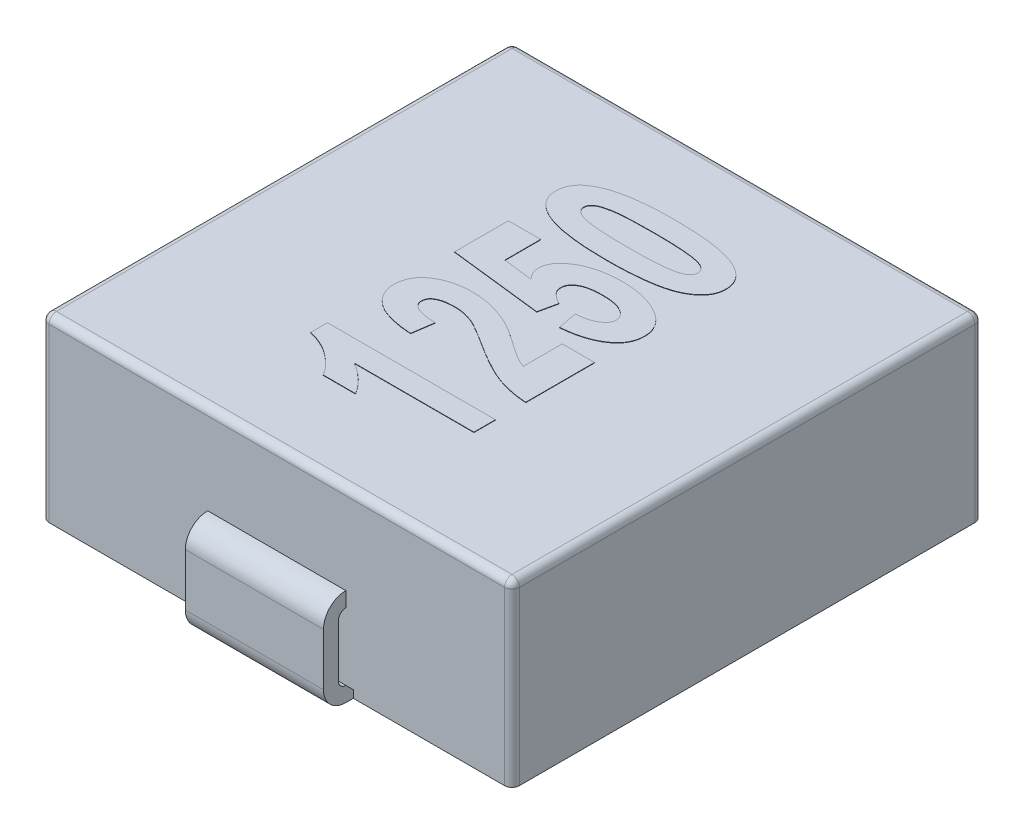
from build123d import *

# Parameters (mm, degrees)
EXTRUDE_1_DEPTH     = 4.8
SKETCH_2_W          = 4.1
SKETCH_2_H          = 3.2
CUT_EXTRUDE_1_DEPTH = 0.2
EXTRUDE_1_2_DEPTH   = 1.85
EXTRUDE_2_DEPTH     = 1.85
FILLET_1_R          = 0.2
EXTRUDE_2_2_DEPTH   = 0.01


with BuildPart() as part:
    # Эскиз1 → Extrude 1 (new body)
    with BuildSketch(Plane(origin=(0, 0, 0), x_dir=(1, 0, 0), z_dir=(0, 1, 0))):
        with BuildLine():
            Line((-6.1, -6.3), (6.1, -6.3))
            ThreePointArc((6.1, -6.3), (6.241421356, -6.241421356), (6.3, -6.1))
            Line((6.3, -6.1), (6.3, 6.1))
            ThreePointArc((6.3, 6.1), (6.241421356, 6.241421356), (6.1, 6.3))
            Line((6.1, 6.3), (-6.1, 6.3))
            ThreePointArc((-6.1, 6.3), (-6.241421356, 6.241421356), (-6.3, 6.1))
            Line((-6.3, 6.1), (-6.3, -6.1))
            ThreePointArc((-6.3, -6.1), (-6.241421356, -6.241421356), (-6.1, -6.3))
        make_face()
    extrude(amount=EXTRUDE_1_DEPTH)

    # Эскиз2 → Вырез-Вытянуть1 (cut)
    with BuildSketch(Plane.XZ):
        with Locations((0, 4.7)):
            Rectangle(SKETCH_2_W, SKETCH_2_H)
        with Locations((0, -4.7)):
            Rectangle(SKETCH_2_W, SKETCH_2_H)
    extrude(amount=-CUT_EXTRUDE_1_DEPTH, mode=Mode.SUBTRACT)

    # Эскиз3 → Extrude 1 2 (add, symmetric)
    with BuildSketch(Plane(origin=(0, 0, 0), x_dir=(0, 0, -1), z_dir=(1, 0, 0))):
        with BuildLine():
            ThreePointArc((-6.3, 2.4), (-6.724264069, 2.224264069), (-6.9, 1.8))
            Line((-6.9, 1.8), (-6.9, 0.4))
            ThreePointArc((-6.9, 0.4), (-6.724264069, -0.024264069), (-6.3, -0.2))
            Line((-6.3, -0.2), (-3.8, -0.2))
            Line((-3.8, -0.2), (-3.8, 0.2))
            Line((-3.8, 0.2), (-6.3, 0.2))
            ThreePointArc((-6.3, 0.2), (-6.441421356, 0.258578644), (-6.5, 0.4))
            Line((-6.5, 0.4), (-6.5, 1.8))
            ThreePointArc((-6.5, 1.8), (-6.441421356, 1.941421356), (-6.3, 2))
            Line((-6.3, 2), (-6.3, 2.4))
        make_face()
    extrude(amount=EXTRUDE_1_2_DEPTH, both=True)

    # Эскиз3<3> → Extrude 2 (add, symmetric)
    with BuildSketch(Plane(origin=(0, 0, 0), x_dir=(0, 0, -1), z_dir=(1, 0, 0))):
        with BuildLine():
            ThreePointArc((6.3, 2.4), (6.724264069, 2.224264069), (6.9, 1.8))
            Line((6.9, 1.8), (6.9, 0.4))
            ThreePointArc((6.9, 0.4), (6.724264069, -0.024264069), (6.3, -0.2))
            Line((6.3, -0.2), (3.8, -0.2))
            Line((3.8, -0.2), (3.8, 0.1))
            Line((3.8, 0.1), (6.3, 0.1))
            ThreePointArc((6.3, 0.1), (6.512132034, 0.187867966), (6.6, 0.4))
            Line((6.6, 0.4), (6.6, 1.8))
            ThreePointArc((6.6, 1.8), (6.512132034, 2.012132034), (6.3, 2.1))
            Line((6.3, 2.1), (6.3, 2.4))
        make_face()
    extrude(amount=EXTRUDE_2_DEPTH, both=True)

    # Скругление1
    fillet_1_edges = [part.edges().sort_by_distance(p)[0] for p in [
        (-6.241421356, 4.8, 6.241421356),
        (-6.3, 4.8, 0),
        (-6.241421356, 4.8, -6.241421356),
        (0, 4.8, -6.3),
        (6.241421356, 4.8, -6.241421356),
        (6.3, 4.8, 0),
        (6.241421356, 4.8, 6.241421356),
        (0, 4.8, 6.3),
    ]]
    fillet(fillet_1_edges, radius=FILLET_1_R)

    # Эскиз4 → Extrude 2 2 (add)
    # profile 1 of 4: a face of its own
    with BuildSketch(Plane(origin=(0, 4.8, 0), x_dir=(1, 0, 0), z_dir=(0, 1, 0))):
        with BuildLine():
            Line((2.3, -2.742307692), (2.3, -3.319230769))
            Line((2.3, -3.319230769), (-0.903725962, -3.319230769))
            add(Edge.make_bspline(
                [(-0.903725962, -3.319230769), (-0.86406372, -3.343713677), (-0.786078708, -3.391852658), (-0.675919252, -3.470855691), (-0.573321827, -3.552688159), (-0.478055637, -3.637116831), (-0.392438312, -3.726154518), (-0.313650575, -3.817422523), (-0.241646265, -3.911528035), (-0.200936704, -3.978406796), (-0.180769231, -4.011538462)],
                knots=[0, 0, 0, 0, 1.105827385, 2.17430884, 3.214432552, 4.219349929, 5.192600286, 6.143147108, 7.080117071, 8, 8, 8, 8], degree=3))
            Line((-0.180769231, -4.011538462), (-1.046153846, -4.011538462))
            add(Edge.make_bspline(
                [(-1.046153846, -4.011538462), (-1.068012691, -3.973910311), (-1.114805226, -3.893360922), (-1.211368323, -3.778972532), (-1.3302216, -3.658579268), (-1.471776622, -3.536727787), (-1.631879563, -3.420391895), (-1.808442443, -3.321497819), (-1.998820885, -3.243911517), (-2.132228541, -3.20897421), (-2.2, -3.191225962)],
                knots=[0, 0, 0, 0, 0.717406847, 1.535730084, 2.462009094, 3.510396949, 4.616124579, 5.724576378, 6.844078492, 8, 8, 8, 8], degree=3))
            Line((-2.2, -3.191225962), (-2.2, -2.742307692))
            Line((-2.2, -2.742307692), (2.3, -2.742307692))
        make_face()
    # profile 2 of 4: a face of its own
    with BuildSketch(Plane(origin=(0, 4.8, 0), x_dir=(1, 0, 0), z_dir=(0, 1, 0))):
        with BuildLine():
            Line((1.434615385, -0.088461538), (2.3, -0.088461538))
            Line((2.3, -0.088461538), (2.3, -1.934615385))
            add(Edge.make_bspline(
                [(2.3, -1.934615385), (2.226259979, -1.928455358), (2.079932751, -1.916231606), (1.864264437, -1.879545312), (1.654338523, -1.82897304), (1.482179213, -1.774531346), (1.342517386, -1.720494417), (1.230154314, -1.670293389), (1.108989011, -1.613191077), (0.981052538, -1.544184217), (0.843567642, -1.469285953), (0.697876089, -1.38518046), (0.545110167, -1.291176511), (0.44084456, -1.225007711), (0.387139423, -1.190925481)],
                knots=[0, 0, 0, 0, 1.2811081, 2.542187998, 3.784214526, 5.018585627, 5.666093998, 6.376792336, 7.149597247, 7.985321744, 8.893657631, 9.861256989, 10.89837609, 12, 12, 12, 12], degree=3))
            add(Edge.make_bspline(
                [(0.387139423, -1.190925481), (0.34421776, -1.163508022), (0.262509471, -1.111314479), (0.144848303, -1.037769714), (0.037849474, -0.973397862), (-0.057912951, -0.915924757), (-0.143416097, -0.867500526), (-0.217924559, -0.826603489), (-0.281986303, -0.794697701), (-0.321628324, -0.777618527), (-0.339423077, -0.769951923)],
                knots=[0, 0, 0, 0, 1.454327433, 2.768546135, 3.961926122, 5.019930819, 5.957524631, 6.767609832, 7.446797167, 8, 8, 8, 8], degree=3))
            add(Edge.make_bspline(
                [(-0.339423077, -0.769951923), (-0.383016183, -0.753744776), (-0.468449265, -0.721982266), (-0.599671217, -0.690011543), (-0.729653911, -0.668849496), (-0.816505367, -0.666532893), (-0.859555288, -0.665384615)],
                knots=[0, 0, 0, 0, 1.045072882, 2.048117354, 3.032504461, 4, 4, 4, 4], degree=3))
            add(Edge.make_bspline(
                [(-0.859555288, -0.665384615), (-0.904382267, -0.666329325), (-0.988621083, -0.668104621), (-1.107026047, -0.683486123), (-1.209631952, -0.707429633), (-1.295525479, -0.743169171), (-1.36365812, -0.788165168), (-1.414633234, -0.841526964), (-1.444123359, -0.905855704), (-1.448023453, -0.951464858), (-1.45, -0.974579327)],
                knots=[0, 0, 0, 0, 1.458031234, 2.739930902, 3.878203939, 4.877043568, 5.750258799, 6.518463336, 7.249165373, 8, 8, 8, 8], degree=3))
            add(Edge.make_bspline(
                [(-1.45, -0.974579327), (-1.448124787, -0.99744213), (-1.444379752, -1.043101988), (-1.412316203, -1.107285885), (-1.358981262, -1.16089113), (-1.301710372, -1.198583705), (-1.245570667, -1.223852816), (-1.195272126, -1.241814151), (-1.138142946, -1.25666623), (-1.07506762, -1.270447388), (-1.005151096, -1.280803325), (-0.928835815, -1.290019186), (-0.845496357, -1.296013356), (-0.787746666, -1.298635416), (-0.757692308, -1.3)],
                knots=[0, 0, 0, 0, 0.977985299, 1.953158208, 3.002652506, 4.194234773, 4.875468122, 5.642662911, 6.484547082, 7.408173722, 8.41360214, 9.517816347, 10.70821063, 12, 12, 12, 12], degree=3))
            Line((-0.757692308, -1.3), (-0.842427885, -1.876923077))
            add(Edge.make_bspline(
                [(-0.842427885, -1.876923077), (-0.900790166, -1.872787934), (-1.013597383, -1.864795205), (-1.175860423, -1.842301441), (-1.325797604, -1.81655978), (-1.462505274, -1.78157562), (-1.587001932, -1.742797624), (-1.699002653, -1.697014574), (-1.797491889, -1.643634289), (-1.884194828, -1.585022897), (-1.958258656, -1.520238872), (-2.023168768, -1.452496054), (-2.077523352, -1.380070687), (-2.121814978, -1.303653792), (-2.157836951, -1.224217332), (-2.181631805, -1.140000853), (-2.198011494, -1.052442493), (-2.199331334, -0.992385559), (-2.2, -0.961959135)],
                knots=[0, 0, 0, 0, 1.543052601, 2.982533657, 4.319726036, 5.554018453, 6.702197742, 7.757705268, 8.740201395, 9.652663645, 10.512474517, 11.331142406, 12.123838954, 12.894713421, 13.657722452, 14.41776096, 15.198396027, 16, 16, 16, 16], degree=3))
            add(Edge.make_bspline(
                [(-2.2, -0.961959135), (-2.198982407, -0.928846362), (-2.196989872, -0.864008682), (-2.180711132, -0.769292784), (-2.152134534, -0.680610173), (-2.114759461, -0.596533247), (-2.063764008, -0.519388573), (-2.003533973, -0.446804567), (-1.930994508, -0.380789266), (-1.849336408, -0.320068584), (-1.759604484, -0.265002951), (-1.662651814, -0.218986675), (-1.561650561, -0.177463388), (-1.45449893, -0.14580066), (-1.342728183, -0.118980287), (-1.225079427, -0.10158587), (-1.102262588, -0.090399872), (-1.018535557, -0.089116141), (-0.975841346, -0.088461538)],
                knots=[0, 0, 0, 0, 0.94559895, 1.851564729, 2.733839678, 3.601929286, 4.470952004, 5.366653288, 6.289938494, 7.265036351, 8.270490059, 9.29164925, 10.327707252, 11.386659859, 12.479746171, 13.60874177, 14.780646081, 16, 16, 16, 16], degree=3))
            add(Edge.make_bspline(
                [(-0.975841346, -0.088461538), (-0.926828777, -0.088961464), (-0.829835872, -0.089950787), (-0.686379789, -0.103669209), (-0.546190423, -0.122572898), (-0.408826845, -0.152365575), (-0.271570531, -0.189521503), (-0.132247162, -0.23586617), (0.01025162, -0.291478564), (0.104620374, -0.335522779), (0.152764423, -0.357992788)],
                knots=[0, 0, 0, 0, 1.004329526, 1.987507276, 2.95182621, 3.902593765, 4.866381389, 5.865635833, 6.911112759, 8, 8, 8, 8], degree=3))
            add(Edge.make_bspline(
                [(0.152764423, -0.357992788), (0.169929347, -0.366633074), (0.206308686, -0.384945295), (0.263291276, -0.415609421), (0.325140461, -0.452001549), (0.393329041, -0.492252782), (0.465660788, -0.539639465), (0.544377258, -0.59043888), (0.627124816, -0.648103678), (0.714191366, -0.707132472), (0.79900291, -0.76751791), (0.879157039, -0.822186323), (0.951637889, -0.871068525), (1.016071339, -0.9142996), (1.073174748, -0.951085472), (1.12170891, -0.983026341), (1.163082139, -1.008498454), (1.227550781, -1.043677512), (1.315771938, -1.088200239), (1.395877139, -1.118554224), (1.434615385, -1.133233173)],
                knots=[0, 0, 0, 0, 0.691072229, 1.464658443, 2.326494152, 3.271626232, 4.31174875, 5.435668429, 6.640564959, 7.938400603, 9.218480418, 10.38441876, 11.427400072, 12.362471323, 13.174714386, 13.870081907, 14.45199856, 14.921154764, 16.51109466, 18, 18, 18, 18], degree=3))
            Line((1.434615385, -1.133233173), (1.434615385, -0.088461538))
        make_face()
    # profile 3 of 4: a face of its own
    with BuildSketch(Plane(origin=(0, 4.8, 0), x_dir=(1, 0, 0), z_dir=(0, 1, 0))):
        with BuildLine():
            Line((1.012740385, 0.257692308), (0.915384615, 0.776923077))
            add(Edge.make_bspline(
                [(0.915384615, 0.776923077), (0.966019091, 0.781555151), (1.062294558, 0.790362491), (1.197572941, 0.81965907), (1.317147573, 0.858418777), (1.418723012, 0.909467894), (1.501639891, 0.967526367), (1.561211457, 1.032693908), (1.600926977, 1.102896011), (1.605459852, 1.153260315), (1.607692308, 1.178064904)],
                knots=[0, 0, 0, 0, 1.407758696, 2.676686699, 3.827332599, 4.881144903, 5.817156249, 6.613060699, 7.316927734, 8, 8, 8, 8], degree=3))
            add(Edge.make_bspline(
                [(1.607692308, 1.178064904), (1.605527196, 1.20582147), (1.601170739, 1.2616709), (1.561696377, 1.34035245), (1.498416821, 1.410039843), (1.428804327, 1.459690658), (1.363057833, 1.496039576), (1.305235314, 1.519002861), (1.242290739, 1.540303411), (1.172321712, 1.55561308), (1.096693375, 1.569761922), (1.014691744, 1.578062896), (0.926884152, 1.583710875), (0.866416801, 1.584307131), (0.83515625, 1.584615385)],
                knots=[0, 0, 0, 0, 1.034051611, 2.080631741, 3.220339062, 4.532041754, 5.261927545, 6.028594457, 6.857440335, 7.746965165, 8.706828443, 9.736649533, 10.829887843, 12, 12, 12, 12], degree=3))
            add(Edge.make_bspline(
                [(0.83515625, 1.584615385), (0.80570754, 1.584181634), (0.748878055, 1.583344592), (0.666063087, 1.579401269), (0.589429456, 1.570065266), (0.5179946, 1.558650511), (0.452759109, 1.543222203), (0.392363605, 1.525769637), (0.338404978, 1.50280458), (0.275580692, 1.470739324), (0.209691008, 1.42382321), (0.150691701, 1.356187944), (0.114355377, 1.278347673), (0.109937111, 1.223207541), (0.107692308, 1.195192308)],
                knots=[0, 0, 0, 0, 1.160657338, 2.239811494, 3.26499666, 4.201332697, 5.088853194, 5.905451448, 6.67511493, 7.39537342, 8.683810976, 9.834580907, 10.899808223, 12, 12, 12, 12], degree=3))
            add(Edge.make_bspline(
                [(0.107692308, 1.195192308), (0.108742486, 1.177337781), (0.110868071, 1.141199826), (0.128349228, 1.088051943), (0.155407614, 1.036287189), (0.194708682, 0.987102177), (0.243951667, 0.939260419), (0.303789487, 0.892480207), (0.37447445, 0.847321568), (0.426555012, 0.820648064), (0.453846154, 0.806670673)],
                knots=[0, 0, 0, 0, 0.781355705, 1.581481109, 2.430142257, 3.331475792, 4.328372929, 5.435417111, 6.656112931, 8, 8, 8, 8], degree=3))
            Line((0.453846154, 0.806670673), (0.347475962, 0.315384615))
            Line((0.347475962, 0.315384615), (-2.142307692, 0.603846154))
            Line((-2.142307692, 0.603846154), (-2.142307692, 2.046153846))
            Line((-2.142307692, 2.046153846), (-1.276923077, 2.046153846))
            Line((-1.276923077, 2.046153846), (-1.276923077, 1.086117788))
            Line((-1.276923077, 1.086117788), (-0.478245192, 0.989663462))
            add(Edge.make_bspline(
                [(-0.478245192, 0.989663462), (-0.503449362, 1.017659338), (-0.551243876, 1.070747747), (-0.60206915, 1.160597694), (-0.636703562, 1.250385919), (-0.640472779, 1.312089267), (-0.642307692, 1.342127404)],
                knots=[0, 0, 0, 0, 1.13196521, 2.146538705, 3.097706579, 4, 4, 4, 4], degree=3))
            add(Edge.make_bspline(
                [(-0.642307692, 1.342127404), (-0.641114745, 1.370182985), (-0.638739666, 1.426039792), (-0.618937113, 1.507850051), (-0.587340134, 1.586620756), (-0.540913479, 1.660746352), (-0.483878522, 1.732538926), (-0.413571416, 1.800647768), (-0.329839803, 1.863922124), (-0.235700598, 1.925359544), (-0.130802553, 1.980356864), (-0.017986303, 2.02943089), (0.102938399, 2.069523753), (0.230692675, 2.104056226), (0.366582261, 2.130193217), (0.510007538, 2.147291104), (0.660655061, 2.159924926), (0.763613529, 2.160992781), (0.816225962, 2.161538462)],
                knots=[0, 0, 0, 0, 0.732921184, 1.459197586, 2.188867425, 2.943624547, 3.737697573, 4.582419474, 5.49568038, 6.478764923, 7.519345437, 8.589420269, 9.692825272, 10.848019096, 12.048643874, 13.308014438, 14.62437823, 16, 16, 16, 16], degree=3))
            add(Edge.make_bspline(
                [(0.816225962, 2.161538462), (0.860707746, 2.160696008), (0.948257785, 2.159037873), (1.07803267, 2.1503753), (1.203673409, 2.133683417), (1.326328746, 2.112481495), (1.444938092, 2.083706926), (1.559847127, 2.047805724), (1.671971582, 2.008454781), (1.743450818, 1.975224771), (1.778966346, 1.958713942)],
                knots=[0, 0, 0, 0, 1.076237228, 2.118274088, 3.144341754, 4.141073316, 5.128403423, 6.094143136, 7.053046493, 8, 8, 8, 8], degree=3))
            add(Edge.make_bspline(
                [(1.778966346, 1.958713942), (1.824560702, 1.93560846), (1.912480885, 1.891053862), (2.030974089, 1.811722839), (2.131354887, 1.725336953), (2.215019846, 1.63330792), (2.279164146, 1.532614611), (2.324542441, 1.425058633), (2.352751502, 1.310810637), (2.35602934, 1.232312804), (2.357692308, 1.192487981)],
                knots=[0, 0, 0, 0, 1.204265861, 2.322201307, 3.35180908, 4.320131538, 5.243761291, 6.151608832, 7.062243516, 8, 8, 8, 8], degree=3))
            add(Edge.make_bspline(
                [(2.357692308, 1.192487981), (2.35676469, 1.16055594), (2.354939145, 1.097713881), (2.337079918, 1.005553732), (2.308307494, 0.918001712), (2.268172799, 0.834822), (2.216187985, 0.756702376), (2.152416367, 0.683637068), (2.077902149, 0.614567895), (1.992206888, 0.551324479), (1.89762616, 0.492634255), (1.794161858, 0.440693012), (1.683393638, 0.393264267), (1.563874231, 0.354571502), (1.43750759, 0.319479548), (1.302630131, 0.293417652), (1.160464881, 0.271200366), (1.062685845, 0.262259365), (1.012740385, 0.257692308)],
                knots=[0, 0, 0, 0, 0.849098194, 1.671020012, 2.487907099, 3.296293733, 4.12143871, 4.977625817, 5.871780044, 6.820291834, 7.807917458, 8.830854905, 9.898850919, 11.01163295, 12.171802797, 13.387352768, 14.665461711, 16, 16, 16, 16], degree=3))
        make_face()
    # profile 4 of 4: a face of its own
    with BuildSketch(Plane(origin=(0, 4.8, 0), x_dir=(1, 0, 0), z_dir=(0, 1, 0))):
        with BuildLine():
            add(Edge.make_bspline(
                [(-2.2, 3.373076923), (-2.198632169, 3.406541916), (-2.195928524, 3.472688596), (-2.17393791, 3.568726795), (-2.136916941, 3.658842095), (-2.086178151, 3.743333936), (-2.019630612, 3.82175966), (-1.93940296, 3.894544409), (-1.844081195, 3.960844007), (-1.774024563, 3.998769435), (-1.737560096, 4.018509615)],
                knots=[0, 0, 0, 0, 0.955393409, 1.888424153, 2.797124692, 3.72908846, 4.691973758, 5.725088377, 6.815908799, 8, 8, 8, 8], degree=3))
            add(Edge.make_bspline(
                [(-1.737560096, 4.018509615), (-1.688355572, 4.041073742), (-1.584699181, 4.088608312), (-1.412616062, 4.144296334), (-1.218811463, 4.19151313), (-1.002228214, 4.229649202), (-0.763392968, 4.260066848), (-0.501999951, 4.281119797), (-0.218151445, 4.293587412), (-0.021527785, 4.295276237), (0.080649038, 4.296153846)],
                knots=[0, 0, 0, 0, 0.700474636, 1.475650333, 2.337255432, 3.282132182, 4.32169542, 5.453938737, 6.676921928, 8, 8, 8, 8], degree=3))
            add(Edge.make_bspline(
                [(0.080649038, 4.296153846), (0.182520791, 4.295226366), (0.378835099, 4.293439045), (0.662468788, 4.281596744), (0.923349076, 4.258499807), (1.162493348, 4.230174318), (1.379097493, 4.190281083), (1.57388549, 4.143397772), (1.747085573, 4.087863144), (1.851181837, 4.03963203), (1.900661058, 4.016706731)],
                knots=[0, 0, 0, 0, 1.317670938, 2.539248156, 3.670516995, 4.704541079, 5.652850057, 6.517238681, 7.295211257, 8, 8, 8, 8], degree=3))
            add(Edge.make_bspline(
                [(1.900661058, 4.016706731), (1.936935669, 3.997421922), (2.006898176, 3.960227489), (2.099725381, 3.892762395), (2.179891364, 3.821570434), (2.244547835, 3.742937207), (2.296064174, 3.658908964), (2.331004327, 3.568073243), (2.353827489, 3.472459429), (2.356390071, 3.406563497), (2.357692308, 3.373076923)],
                knots=[0, 0, 0, 0, 1.179332592, 2.274567848, 3.289398841, 4.252461845, 5.189941122, 6.108820401, 7.038952423, 8, 8, 8, 8], degree=3))
            add(Edge.make_bspline(
                [(2.357692308, 3.373076923), (2.356111938, 3.33928105), (2.35298281, 3.272365289), (2.328568164, 3.174926845), (2.289622314, 3.082365545), (2.233152464, 2.996023915), (2.161932227, 2.914125028), (2.074642727, 2.837620286), (1.971889284, 2.766502376), (1.853110237, 2.699816718), (1.713978213, 2.639479825), (1.550761422, 2.589566752), (1.364161273, 2.545361838), (1.152570574, 2.511279448), (0.917093552, 2.483481322), (0.656912424, 2.464579075), (0.372553845, 2.451294049), (0.174716985, 2.450443287), (0.071634615, 2.45)],
                knots=[0, 0, 0, 0, 0.600476196, 1.188941655, 1.775584294, 2.378931158, 3.015403394, 3.700645778, 4.437482328, 5.234265339, 6.119850578, 7.12887988, 8.26569383, 9.528207572, 10.938146564, 12.481751003, 14.166825734, 16, 16, 16, 16], degree=3))
            add(Edge.make_bspline(
                [(0.071634615, 2.45), (-0.029637869, 2.450918877), (-0.225054234, 2.452691952), (-0.507464235, 2.464681281), (-0.767856339, 2.487258639), (-1.006124505, 2.517431937), (-1.222433593, 2.555504375), (-1.416444553, 2.602977335), (-1.589399048, 2.658262564), (-1.693491392, 2.706512751), (-1.74296875, 2.729447115)],
                knots=[0, 0, 0, 0, 1.313729961, 2.534986055, 3.665680208, 4.703219291, 5.64977019, 6.512901895, 7.293149888, 8, 8, 8, 8], degree=3))
            add(Edge.make_bspline(
                [(-1.74296875, 2.729447115), (-1.779249112, 2.74872748), (-1.849222709, 2.785913342), (-1.941973153, 2.853437761), (-2.022576181, 2.924581159), (-2.086265463, 3.003938175), (-2.138661688, 3.087358347), (-2.173259046, 3.178114815), (-2.196149009, 3.273685487), (-2.198702422, 3.33958734), (-2.2, 3.373076923)],
                knots=[0, 0, 0, 0, 1.179437609, 2.274770394, 3.289691756, 4.259516136, 5.189690891, 6.108651995, 7.038866843, 8, 8, 8, 8], degree=3))
        make_face()
        with BuildLine():
            add(Edge.make_bspline(
                [(-1.45, 3.373076923), (-1.448691519, 3.357290189), (-1.446040076, 3.325300725), (-1.426971445, 3.279330915), (-1.395629219, 3.236792632), (-1.352190569, 3.196268327), (-1.292366363, 3.159754105), (-1.214260696, 3.128942336), (-1.117650501, 3.10273304), (-1.046567152, 3.089198533), (-1.008293269, 3.081911058)],
                knots=[0, 0, 0, 0, 0.66053735, 1.338480494, 2.051183008, 2.861689582, 3.811811342, 4.969049189, 6.368024884, 8, 8, 8, 8], degree=3))
            add(Edge.make_bspline(
                [(-1.008293269, 3.081911058), (-0.979167601, 3.077558059), (-0.916238503, 3.068152942), (-0.814682115, 3.056335709), (-0.698844576, 3.048172735), (-0.569688705, 3.039423533), (-0.426574114, 3.034869929), (-0.270040009, 3.029983029), (-0.099347104, 3.027417798), (0.019049905, 3.027092383), (0.080649038, 3.026923077)],
                knots=[0, 0, 0, 0, 0.647628605, 1.399270384, 2.247685976, 3.201110699, 4.24594481, 5.39623077, 6.6453211, 8, 8, 8, 8], degree=3))
            add(Edge.make_bspline(
                [(0.080649038, 3.026923077), (0.141946534, 3.027202681), (0.259435939, 3.027738601), (0.428037259, 3.028837785), (0.581576683, 3.033787478), (0.720391479, 3.039262629), (0.84431497, 3.044616467), (0.953025587, 3.054278395), (1.046936906, 3.063449685), (1.148697632, 3.078768311), (1.255359024, 3.099427492), (1.363071498, 3.128707949), (1.447677065, 3.159908067), (1.510270485, 3.196362159), (1.553364913, 3.237483961), (1.585926522, 3.278816493), (1.603449541, 3.325540635), (1.606287151, 3.35733344), (1.607692308, 3.373076923)],
                knots=[0, 0, 0, 0, 1.772229522, 3.396846643, 4.874325468, 6.213183949, 7.413572011, 8.459660885, 9.368179202, 10.14095794, 11.434081607, 12.506883432, 13.365124891, 14.035567992, 14.582591736, 15.079517174, 15.544185971, 16, 16, 16, 16], degree=3))
            add(Edge.make_bspline(
                [(1.607692308, 3.373076923), (1.606475274, 3.389198428), (1.604053404, 3.421279864), (1.58411044, 3.467093502), (1.553969183, 3.510217798), (1.509453595, 3.5497474), (1.450148708, 3.586486647), (1.371921102, 3.617180718), (1.275353079, 3.64343072), (1.204263054, 3.656958783), (1.165985577, 3.664242788)],
                knots=[0, 0, 0, 0, 0.672803919, 1.338864841, 2.061605897, 2.863308736, 3.813131099, 4.970004284, 6.368539142, 8, 8, 8, 8], degree=3))
            add(Edge.make_bspline(
                [(1.165985577, 3.664242788), (1.13685903, 3.668588372), (1.074223261, 3.677933418), (0.973279866, 3.689836338), (0.858339677, 3.69797886), (0.729786941, 3.706760957), (0.586970322, 3.711277379), (0.430436773, 3.716172832), (0.260044161, 3.718730831), (0.141947673, 3.719059942), (0.080649038, 3.719230769)],
                knots=[0, 0, 0, 0, 0.649769229, 1.397309303, 2.24191953, 3.191878681, 4.240166309, 5.394254338, 6.647473319, 8, 8, 8, 8], degree=3))
            add(Edge.make_bspline(
                [(0.080649038, 3.719230769), (0.019351516, 3.718952325), (-0.098137939, 3.718418628), (-0.267039275, 3.717302306), (-0.420879862, 3.712382152), (-0.55999576, 3.706901129), (-0.68421455, 3.701488179), (-0.793234467, 3.691928811), (-0.887440225, 3.682691451), (-0.988915597, 3.667464502), (-1.095258315, 3.646640888), (-1.2028883, 3.617263404), (-1.288204818, 3.586272054), (-1.351412419, 3.549648033), (-1.395864883, 3.509303603), (-1.426944145, 3.466797132), (-1.446046559, 3.420859247), (-1.448693661, 3.388865681), (-1.45, 3.373076923)],
                knots=[0, 0, 0, 0, 1.769047239, 3.390747135, 4.874240912, 6.210695287, 7.408927887, 8.461780351, 9.368667298, 10.140058405, 11.422355672, 12.493231132, 13.358012728, 14.034682899, 14.587091034, 15.078019327, 15.545004449, 16, 16, 16, 16], degree=3))
        make_face(mode=Mode.SUBTRACT)
    extrude(amount=EXTRUDE_2_2_DEPTH)


solid = part.part
